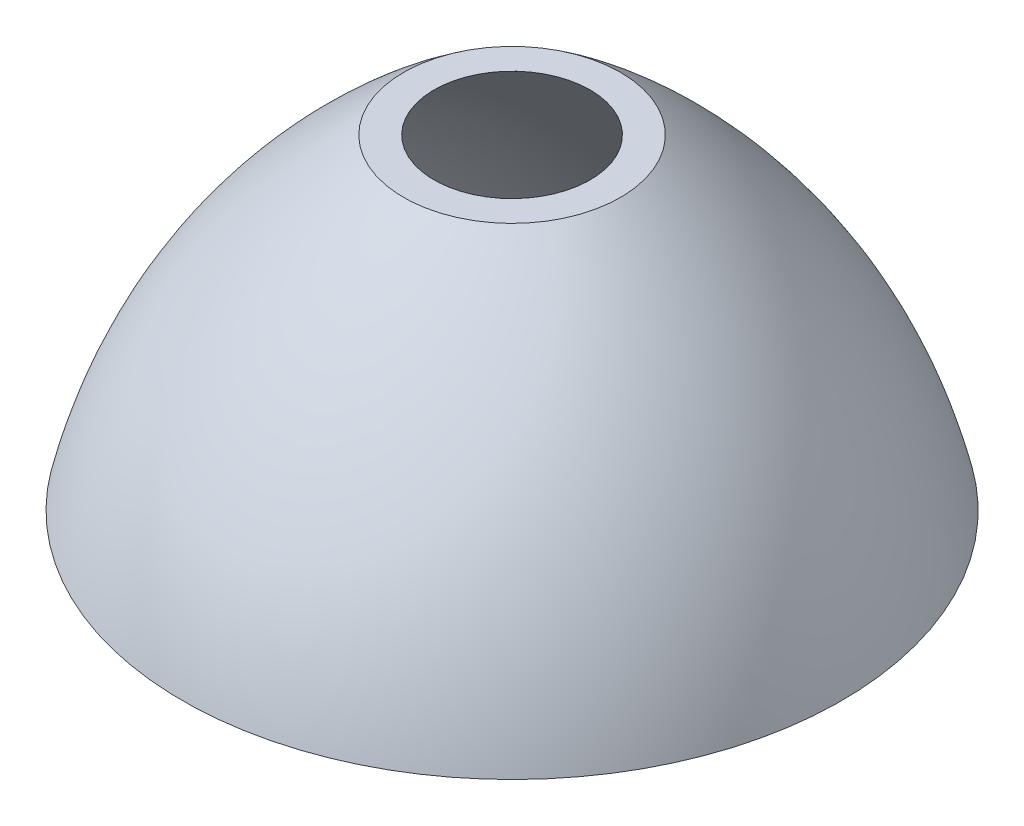
from build123d import *


with BuildPart() as part:
    # Sketch1 → Revolve1 (revolve)
    with BuildSketch(Plane.XY):
        with BuildLine():
            Line((-18, 75), (-25, 75))
            add(Edge.make_bspline(
                [(-76, 0), (-65.367984326, 45.353440289), (-25, 75)],
                knots=[0, 0, 0, 1, 1, 1], degree=2))
            Line((-76, 0), (-75, 0))
            add(Edge.make_bspline(
                [(-75, 0), (-58.406274113, 46.597036045), (-18, 75)],
                knots=[0, 0, 0, 1, 1, 1], degree=2))
        make_face()
    revolve(axis=Axis((0, 0, 0), (0, 1, 0)))


solid = part.part
